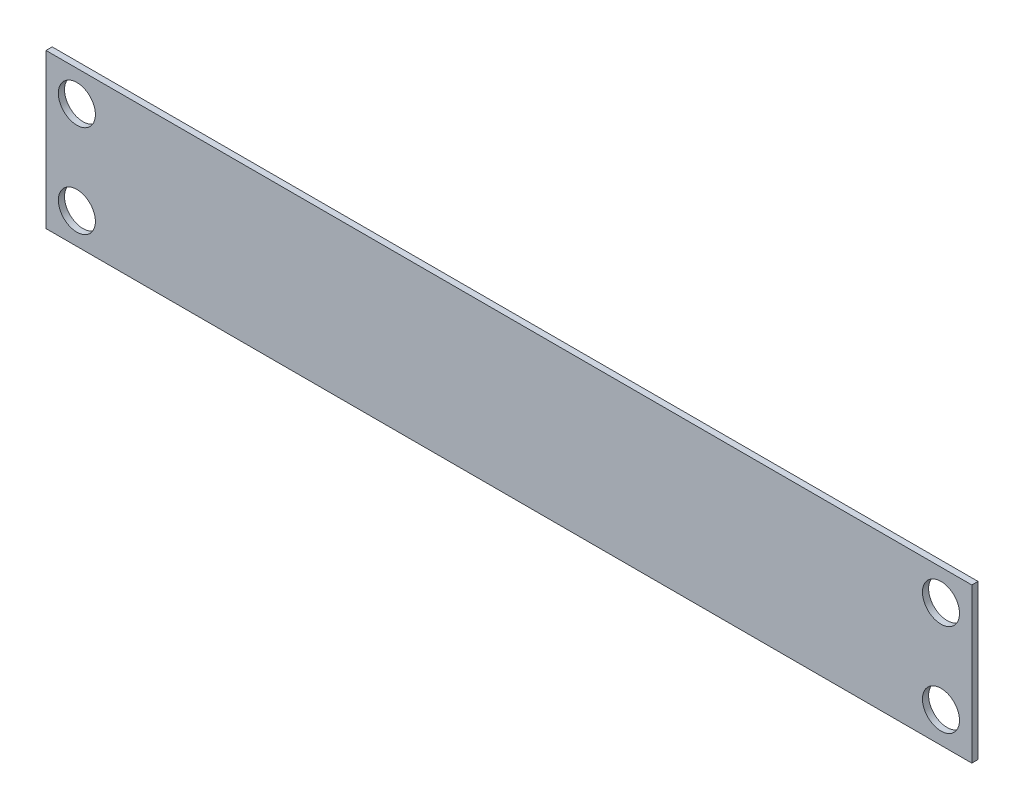
from build123d import *

# Parameters (mm, degrees)
CROQUIS1_W                = 300
CROQUIS1_H                = 50
SALIENTE_EXTRUIR1_DEPTH   = 2
CROQUIS2_R                = 6
CORTAR_EXTRUIR1_DEPTH     = 153.082214608
SIMETR_A2_COPY_1_SKETCH_R = 6
SIMETR_A2_COPY_1_DEPTH    = 153.082214608


with BuildPart() as part:
    # Croquis1 → Saliente-Extruir1 (new body)
    with BuildSketch(Plane.XY):
        Rectangle(CROQUIS1_W, CROQUIS1_H)
    extrude(amount=SALIENTE_EXTRUIR1_DEPTH)

    # Croquis2 → Cortar-Extruir1 (cut, through all)
    with BuildSketch(Plane.XY.offset(2)):
        with Locations((-140, -15)):
            Circle(CROQUIS2_R)
    cortar_extruir1 = extrude(amount=-CORTAR_EXTRUIR1_DEPTH, mode=Mode.SUBTRACT)

    # Simetría1: Cortar-Extruir1 across plane
    add(cortar_extruir1.mirror(Plane.ZX), mode=Mode.SUBTRACT)

    # Simetría2: Cortar-Extruir1 across plane
    add(cortar_extruir1.mirror(Plane(origin=(0, 0, 0), x_dir=(0, 0, 1), z_dir=(1, 0, 0))), mode=Mode.SUBTRACT)

    # Simetría2 copy 1 sketch → Simetría2 copy 1 (cut, through all)
    with BuildSketch(Plane(origin=(0, 0, 2), x_dir=(-1, 0, 0), z_dir=(0, 0, 1))):
        with Locations((-140, -15)):
            Circle(SIMETR_A2_COPY_1_SKETCH_R)
    extrude(amount=-SIMETR_A2_COPY_1_DEPTH, mode=Mode.SUBTRACT)


solid = part.part
